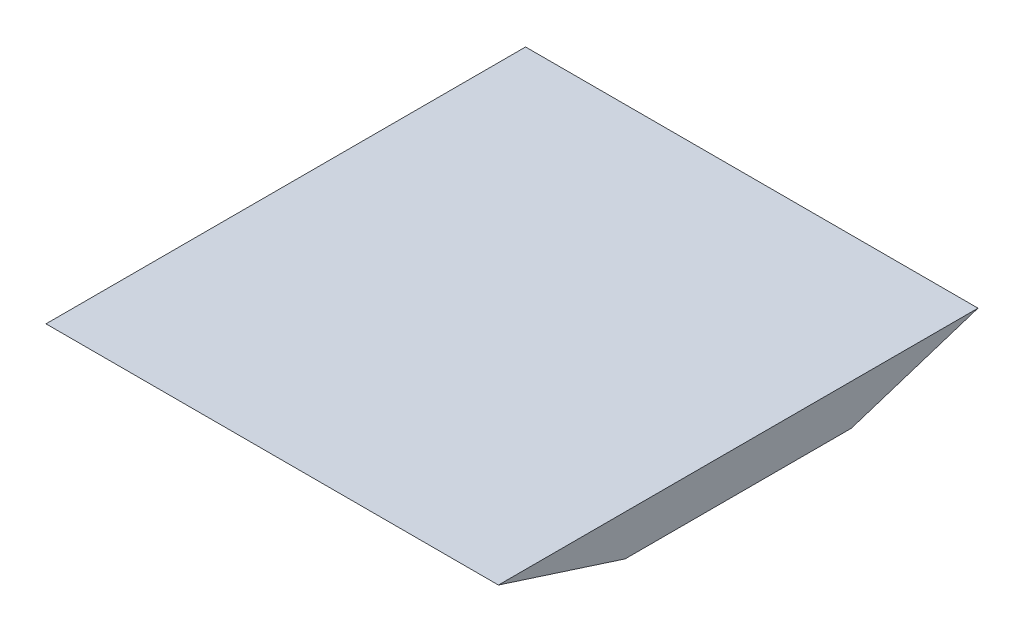
from build123d import *

# Parameters (mm, degrees)
BOSS_EXTRUDE1_DEPTH = 100


with BuildPart() as part:
    # Sketch1 → Boss-Extrude1 (new body)
    with BuildSketch(Plane(origin=(0, 0, 0), x_dir=(0, 0, -1), z_dir=(1, 0, 0))):
        Polygon((0, 0), (106, 0), (78, -9), (28, -9), align=None)
    extrude(amount=BOSS_EXTRUDE1_DEPTH)


solid = part.part
